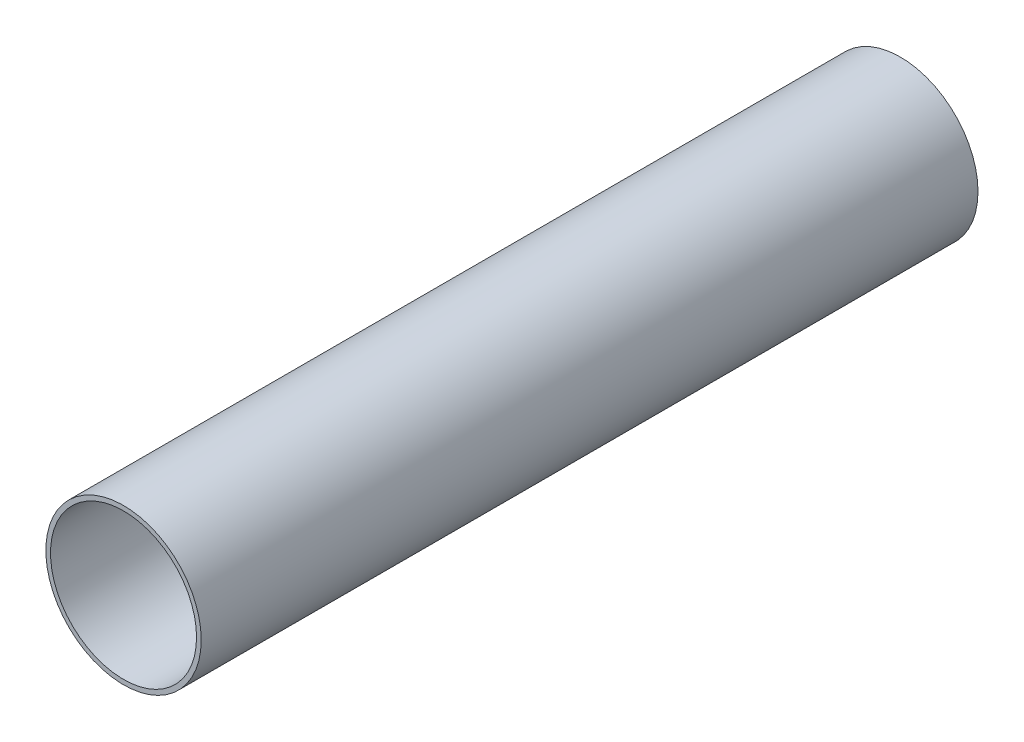
from build123d import *

# Parameters (mm, degrees)
SKETCH1_R           = 50
SKETCH1_R_2         = 47
BOSS_EXTRUDE1_DEPTH = 500
SKETCH2_R           = 35
CUT_EXTRUDE1_DEPTH  = 500


with BuildPart() as part:
    # Sketch1 → Boss-Extrude1 (new body)
    with BuildSketch(Plane.XY):
        Circle(SKETCH1_R)
        Circle(SKETCH1_R_2, mode=Mode.SUBTRACT)
    extrude(amount=BOSS_EXTRUDE1_DEPTH)

    # Sketch2 → Cut-Extrude1 (cut)
    with BuildSketch(Plane(origin=(0, 0, 0), x_dir=(1, 0, 0), z_dir=(0, 1, 0))):
        with Locations(Location((0, -130, 0), (0, 0, 270))):
            Circle(SKETCH2_R)
        with Locations(Location((0, -340, 0), (0, 0, 270))):
            Circle(SKETCH2_R)
    extrude(amount=-CUT_EXTRUDE1_DEPTH, mode=Mode.SUBTRACT)


solid = part.part
